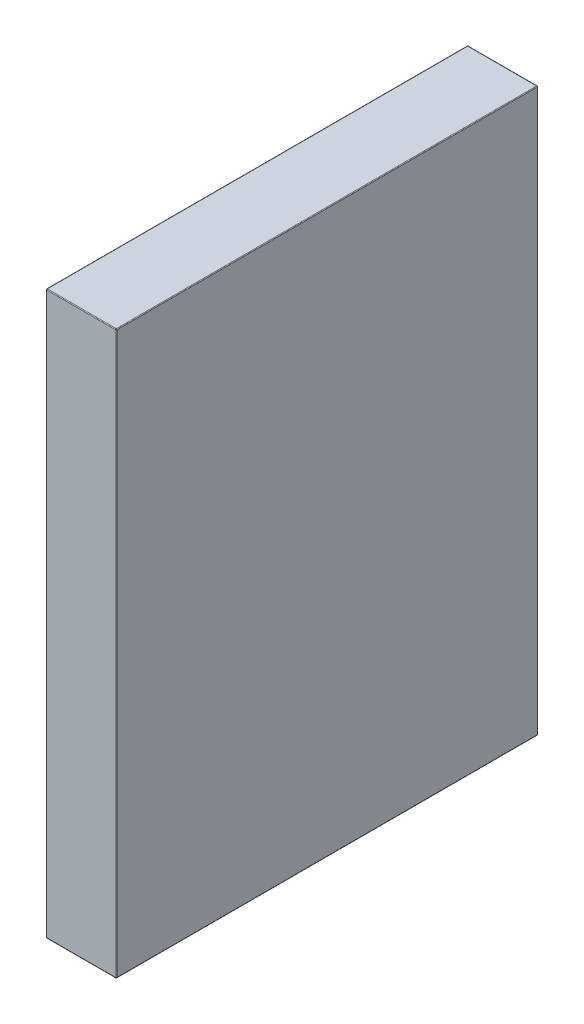
from build123d import *

# Parameters (mm, degrees)
SKETCH1_W           = 80
SKETCH1_H           = 10
BOSS_EXTRUDE1_DEPTH = 60
FILLET1_R           = 0.1


with BuildPart() as part:
    # Sketch1 → Boss-Extrude1 (new body)
    with BuildSketch(Plane(origin=(0, 0, 0), x_dir=(0, 1, 0), z_dir=(0, 0, 1))):
        Rectangle(SKETCH1_W, SKETCH1_H)
    extrude(amount=BOSS_EXTRUDE1_DEPTH)

    # Fillet1
    fillet1_edges = [part.edges().sort_by_distance(p)[0] for p in [
        (0, -40, 60),
        (5, 0, 60),
        (0, 40, 60),
        (5, 0, 0),
        (0, -40, 0),
        (-5, 0, 0),
        (0, 40, 0),
        (5, 40, 30),
        (5, -40, 30),
        (-5, -40, 30),
        (-5, 40, 30),
        (-5, 0, 60),
    ]]
    fillet(fillet1_edges, radius=FILLET1_R)


solid = part.part
